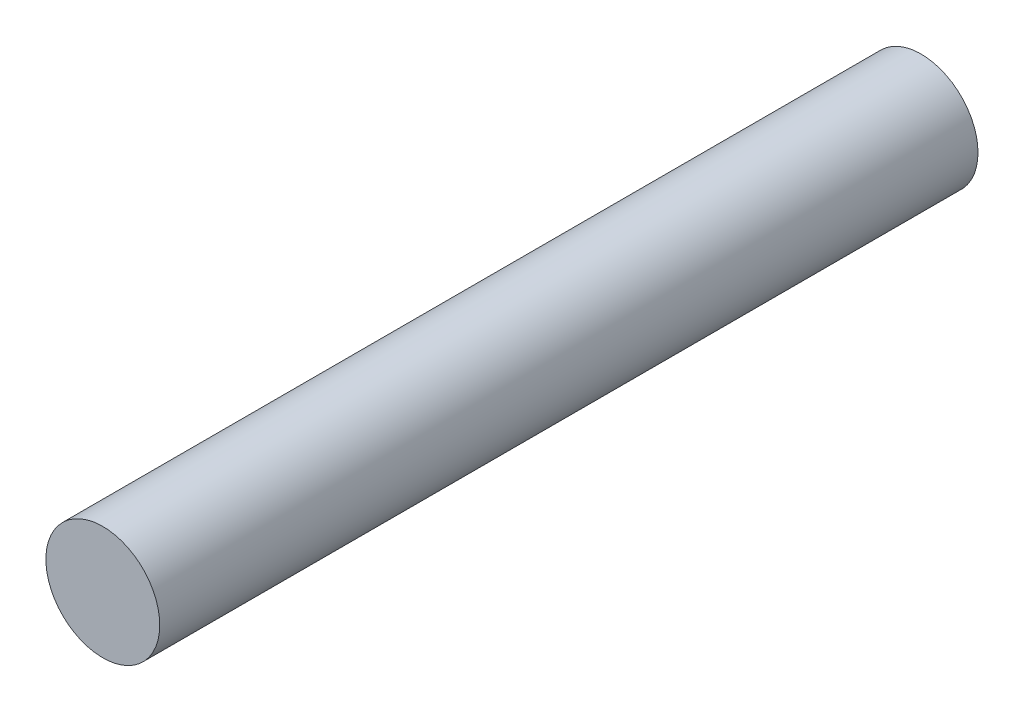
from build123d import *

# Parameters (mm, degrees)
SKETCH1_R           = 3.2
BOSS_EXTRUDE1_DEPTH = 46
SCALE_1_SCALE       = 2


with BuildPart() as part:
    # Sketch1 → Boss-Extrude1 (new body)
    with BuildSketch(Plane.XY):
        Circle(SKETCH1_R)
    extrude(amount=BOSS_EXTRUDE1_DEPTH)


with BuildPart() as part_1:
    # 缩放比例1: scaled about (0, 0, 23)
    add(part.part.scale(SCALE_1_SCALE).moved(Location((0, 0, -23))))


solid = part_1.part
